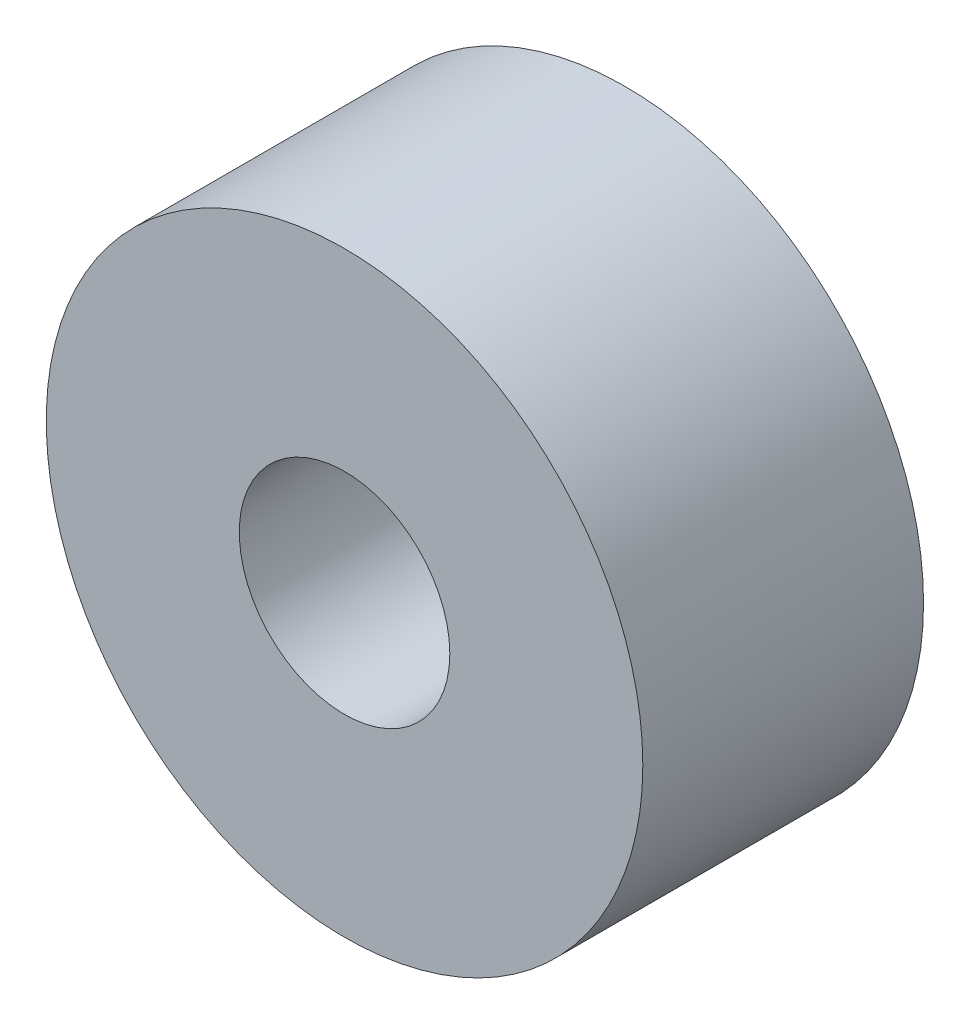
from build123d import *

# Parameters (mm, degrees)
SKETCH_1_W = 16
SKETCH_1_H = 11


with BuildPart() as part:
    # 草图1 → 旋转1 (revolve)
    with BuildSketch(Plane(origin=(0, 0, 0), x_dir=(0, 0, -1), z_dir=(1, 0, 0)), mode=Mode.PRIVATE) as revolve_1_sk:
        with Locations((47, 11.5)):
            Rectangle(SKETCH_1_W, SKETCH_1_H)
    revolve(revolve_1_sk.sketch.rotate(Axis((0, 0, -34), (0, 0, -1)), 90), axis=Axis((0, 0, -34), (0, 0, -1)))


solid = part.part
